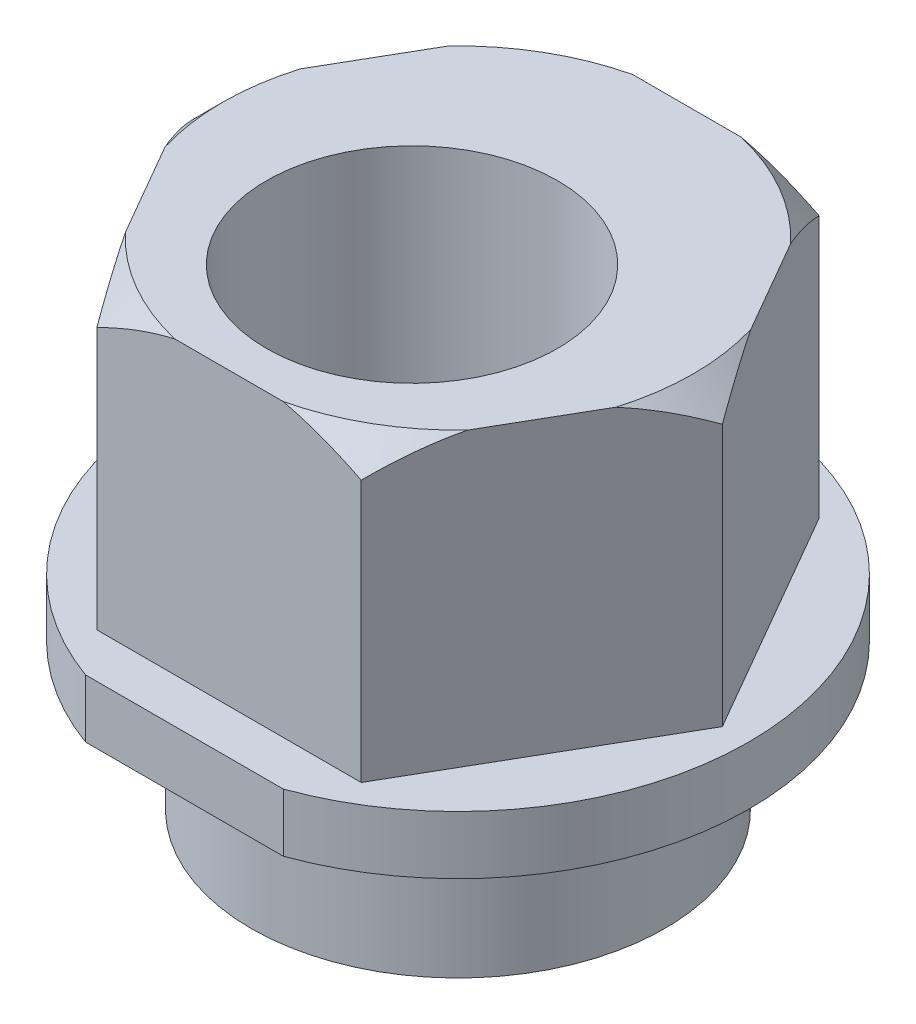
from build123d import *

# Parameters (mm, degrees)
BOSS_EXTRUDE1_DEPTH = 5
SKETCH2_R           = 5
BOSS_EXTRUDE2_DEPTH = 1
SKETCH3_R           = 3.555
BOSS_EXTRUDE3_DEPTH = 2.5
SKETCH4_R           = 2.5
CUT_EXTRUDE1_DEPTH  = 12.056672194
CUT_EXTRUDE2_DEPTH  = 9.660254038


with BuildPart() as part:
    # Sketch1 → Boss-Extrude1 (new body)
    with BuildSketch(Plane(origin=(0, 0, 0), x_dir=(1, 0, 0), z_dir=(0, 1, 0))):
        Polygon((4.543746619, 0), (2.271873309, 3.935), (-2.271873309, 3.935), (-4.543746619, 0), (-2.271873309, -3.935), (2.271873309, -3.935), align=None)
    extrude(amount=BOSS_EXTRUDE1_DEPTH)

    # Sketch2 → Boss-Extrude2 (add)
    with BuildSketch(Plane(origin=(0, 0, 0), x_dir=(1, 0, 0), z_dir=(0, 1, 0))):
        with Locations(Location((0, 0, 0), (0, 0, 270))):
            Circle(SKETCH2_R)
    extrude(amount=-BOSS_EXTRUDE2_DEPTH)

    # Sketch3 → Boss-Extrude3 (add)
    with BuildSketch(Plane.XZ.offset(1)):
        with Locations(Location((0, 0, 0), (0, 0, 90))):
            Circle(SKETCH3_R)
    extrude(amount=BOSS_EXTRUDE3_DEPTH)

    # Sketch4 → Cut-Extrude1 (cut, through all)
    with BuildSketch(Plane(origin=(0, 5, 0), x_dir=(1, 0, 0), z_dir=(0, 1, 0))):
        with Locations(Location((0, -0.79, 0), (0, 0, 270))):
            Circle(SKETCH4_R)
    extrude(amount=-CUT_EXTRUDE1_DEPTH, mode=Mode.SUBTRACT)

    # Sketch5 → Cut-Extrude2 (cut, through all)
    with BuildSketch(Plane(origin=(0, 0, 0), x_dir=(1, 0, 0), z_dir=(0, 1, 0))):
        with BuildLine():
            Line((-1.7, -4.702127178), (1.7, -4.702127178))
            ThreePointArc((1.7, -4.702127178), (0, -5), (-1.7, -4.702127178))
        make_face()
    extrude(amount=-CUT_EXTRUDE2_DEPTH, mode=Mode.SUBTRACT)

    # Sketch6 → Cut-Revolve1 (revolve, cut)
    with BuildSketch(Plane.XY):
        Polygon((4.043746619, 5), (4.543746619, 5), (4.543746619, 4.5), align=None)
    revolve(axis=Axis((0, 0, 0), (0, 1, 0)), mode=Mode.SUBTRACT)


solid = part.part
